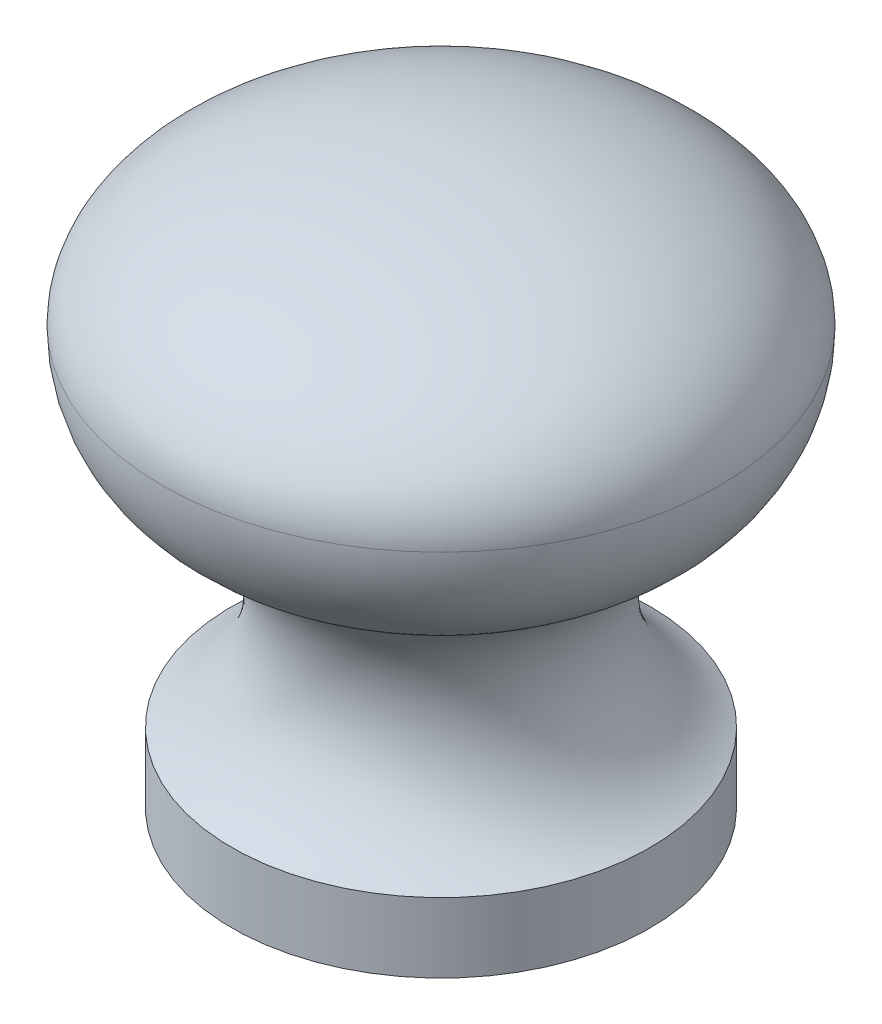
from build123d import *

# Parameters (mm, degrees)
F_8_32_TAPPED_HOLE1_D           = 3.4544
F_8_32_TAPPED_HOLE1_DEPTH       = 15.07744
F_8_32_TAPPED_HOLE1_CBORE_D     = 4.1656
F_8_32_TAPPED_HOLE1_CBORE_DEPTH = 12.7
F_8_32_TAPPED_HOLE1_TIP         = 1.037806461


with BuildPart() as part:
    # Sketch1 → Base-Revolve (revolve)
    with BuildSketch(Plane.XY, mode=Mode.PRIVATE) as base_revolve_sk:
        with BuildLine():
            Line((0, 0), (-9.525, 0))
            Line((-9.525, 0), (-9.525, 3.175))
            ThreePointArc((-9.525, 3.175), (-6.350520234, 8.282737448), (-9.387318408, 13.47351393))
            ThreePointArc((-9.387318408, 13.47351393), (-11.809371387, 15.806889756), (-12.7, 19.05))
            add(Edge.make_bspline(
                [(0, 25.4), (-12.7, 25.4), (-12.7, 19.05)],
                knots=[4.71238898, 4.71238898, 4.71238898, 6.283185307, 6.283185307, 6.283185307], degree=2, weights=[1, 0.707106781, 1]))
            Line((0, 25.4), (0, 0))
        make_face()
    revolve(base_revolve_sk.sketch.rotate(Axis((0, 0, 0), (0, 1, 0)), 270), axis=Axis((0, 0, 0), (0, 1, 0)))

    # #8-32 Tapped Hole1
    with Locations(Plane.XZ):
        with Locations((0, 0)):
            CounterBoreHole(F_8_32_TAPPED_HOLE1_D / 2, F_8_32_TAPPED_HOLE1_CBORE_D / 2, F_8_32_TAPPED_HOLE1_CBORE_DEPTH, depth=F_8_32_TAPPED_HOLE1_DEPTH)
            with Locations((0, 0, -(F_8_32_TAPPED_HOLE1_DEPTH + F_8_32_TAPPED_HOLE1_TIP / 2))):  # 118° drill point
                Cone(0, F_8_32_TAPPED_HOLE1_D / 2, F_8_32_TAPPED_HOLE1_TIP, mode=Mode.SUBTRACT)


solid = part.part
